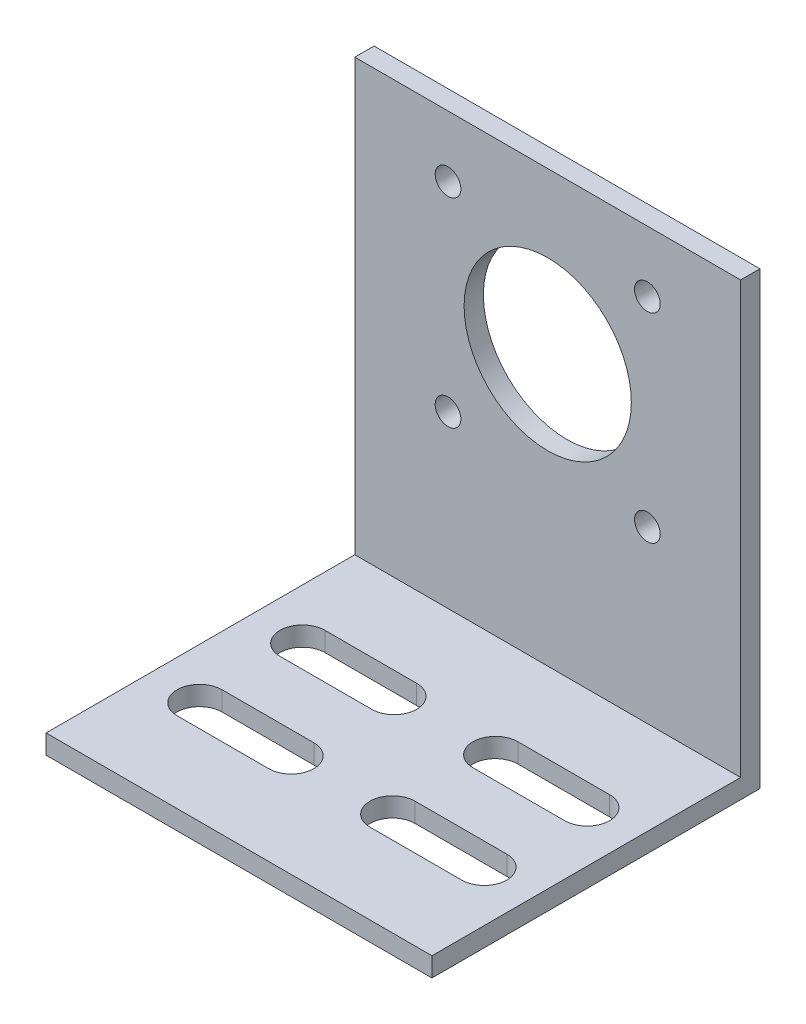
from build123d import *

# Parameters (mm, degrees)
SKETCH_1_W               = 60
SKETCH_1_H               = 70
SKETCH_1_R               = 13
EXTRUDE_1_DEPTH          = 3
SKETCH_2_W               = 60
SKETCH_2_H               = 51
EXTRUDE_2_DEPTH          = 3
SKETCH_3_R               = 2
CUT_EXTRUDE_1_DEPTH      = 10
MIRROR_3_COPY_1_SKETCH_R = 2
MIRROR_3_COPY_1_DEPTH    = 10
CUT_EXTRUDE_2_DEPTH      = 10
MIRROR_5_COPY_1_DEPTH    = 10


with BuildPart() as part:
    # 草图1 → 凸台-拉伸1 (new body)
    with BuildSketch(Plane.XY):
        with Locations((0, -9.5)):
            Rectangle(SKETCH_1_W, SKETCH_1_H)
        with Locations((0, 0.5)):
            Circle(SKETCH_1_R, mode=Mode.SUBTRACT)
    extrude(amount=EXTRUDE_1_DEPTH)

    # 草图2 → 凸台-拉伸2 (add)
    with BuildSketch(Plane.XZ.offset(44.5)):
        with Locations((0, 25.5)):
            Rectangle(SKETCH_2_W, SKETCH_2_H)
    extrude(amount=-EXTRUDE_2_DEPTH)

    # 草图3 → 切除-拉伸1 (cut)
    with BuildSketch(Plane.XY.offset(3)):
        with Locations((-15.5, 16)):
            Circle(SKETCH_3_R)
    cut_extrude_1 = extrude(amount=-CUT_EXTRUDE_1_DEPTH, mode=Mode.SUBTRACT)

    # 镜向1: 切除-拉伸1 across plane
    add(cut_extrude_1.mirror(Plane(origin=(0, 0, 0), x_dir=(0, 0, 1), z_dir=(1, 0, 0))), mode=Mode.SUBTRACT)

    # 镜向3: 切除-拉伸1 across plane
    add(cut_extrude_1.mirror(Plane.ZX.offset(0.5)), mode=Mode.SUBTRACT)

    # 镜向3 copy 1 sketch → 镜向3 copy 1 (cut)
    with BuildSketch(Plane(origin=(0, 1, 3), x_dir=(-1, 0, 0), z_dir=(0, 0, 1))):
        with Locations((-15.5, 16)):
            Circle(MIRROR_3_COPY_1_SKETCH_R)
    extrude(amount=-MIRROR_3_COPY_1_DEPTH, mode=Mode.SUBTRACT)

    # 草图4 → 切除-拉伸2 (cut)
    with BuildSketch(Plane(origin=(0, -41.5, 0), x_dir=(1, 0, 0), z_dir=(0, 1, 0))):
        with BuildLine():
            Line((-22.132037459, -15.5), (-7.867962541, -15.5))
            ThreePointArc((-7.867962541, -15.5), (-4.367962541, -19), (-7.867962541, -22.5))
            Line((-7.867962541, -22.5), (-22.132037459, -22.5))
            ThreePointArc((-22.132037459, -22.5), (-25.632037459, -19), (-22.132037459, -15.5))
        make_face()
    cut_extrude_2 = extrude(amount=-CUT_EXTRUDE_2_DEPTH, mode=Mode.SUBTRACT)

    # 镜向4: 切除-拉伸2 across plane
    add(cut_extrude_2.mirror(Plane.XY.offset(27)), mode=Mode.SUBTRACT)

    # 镜向5: 切除-拉伸2 across plane
    add(cut_extrude_2.mirror(Plane(origin=(0, 0, 0), x_dir=(0, 0, 1), z_dir=(1, 0, 0))), mode=Mode.SUBTRACT)

    # 镜向5 copy 1 sketch → 镜向5 copy 1 (cut)
    with BuildSketch(Plane(origin=(0, -41.5, 54), x_dir=(-1, 0, 0), z_dir=(0, 1, 0))):
        with BuildLine():
            Line((-22.132037459, -15.5), (-7.867962541, -15.5))
            ThreePointArc((-7.867962541, -15.5), (-4.367962541, -19), (-7.867962541, -22.5))
            Line((-7.867962541, -22.5), (-22.132037459, -22.5))
            ThreePointArc((-22.132037459, -22.5), (-25.632037459, -19), (-22.132037459, -15.5))
        make_face()
    extrude(amount=-MIRROR_5_COPY_1_DEPTH, mode=Mode.SUBTRACT)


solid = part.part
